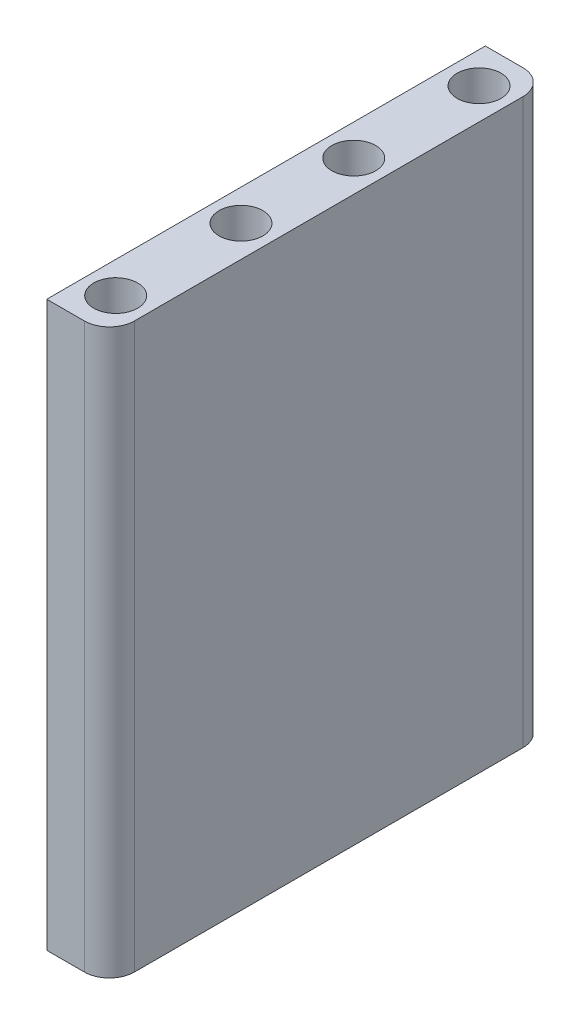
from build123d import *

# Parameters (mm, degrees)
SKETCH1_R           = 1.75
BOSS_EXTRUDE1_DEPTH = 45


with BuildPart() as part:
    # Sketch1 → Boss-Extrude1 (new body)
    with BuildSketch(Plane(origin=(0, 0, 0), x_dir=(1, 0, 0), z_dir=(0, 1, 0))):
        with BuildLine():
            Line((0, 35), (3, 35))
            ThreePointArc((3, 35), (4.414213562, 34.414213562), (5, 33))
            Line((5, 33), (5, 2))
            ThreePointArc((5, 2), (4.414213562, 0.585786438), (3, 0))
            Line((3, 0), (0, 0))
            Line((0, 0), (0, 35))
        make_face()
        with Locations(Location((2.5, 32, 0), (0, 0, 90))):
            Circle(SKETCH1_R, mode=Mode.SUBTRACT)
        with Locations(Location((2.5, 22, 0), (0, 0, 90))):
            Circle(SKETCH1_R, mode=Mode.SUBTRACT)
        with Locations(Location((2.5, 13, 0), (0, 0, 90))):
            Circle(SKETCH1_R, mode=Mode.SUBTRACT)
        with Locations(Location((2.5, 3, 0), (0, 0, 90))):
            Circle(SKETCH1_R, mode=Mode.SUBTRACT)
    extrude(amount=BOSS_EXTRUDE1_DEPTH)


solid = part.part
